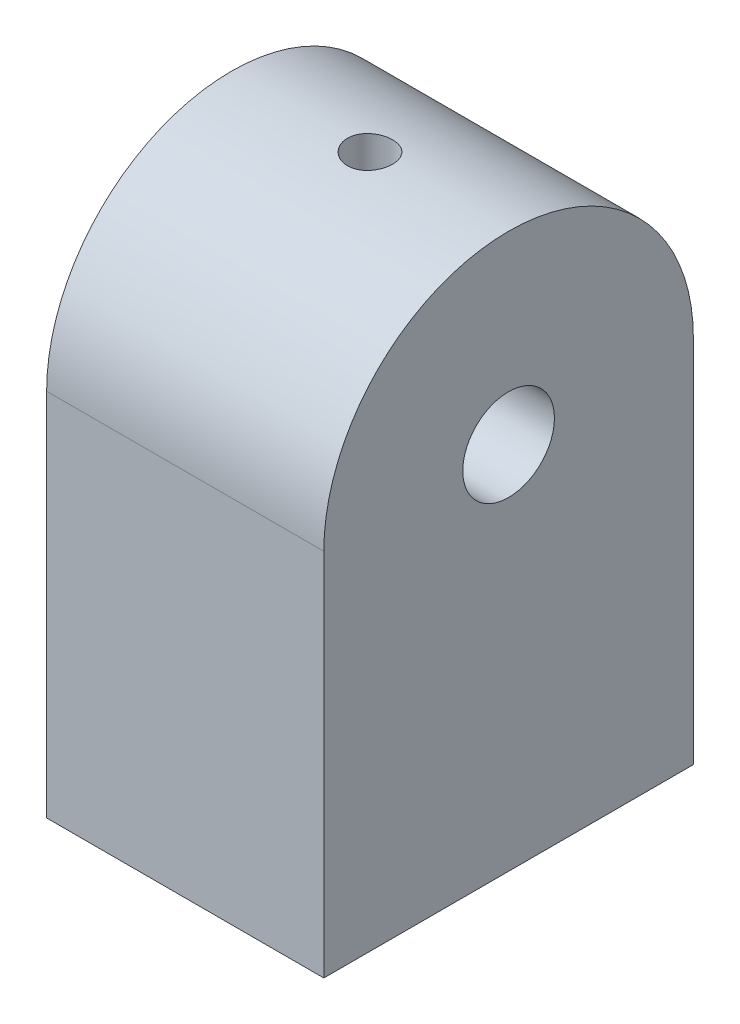
from build123d import *

# Parameters (mm, degrees)
SKETCH1_R               = 12.7
SKETCH1_R_2             = 3.15
BOSS_EXTRUDE1_DEPTH     = 19.05
BOSS_EXTRUDE2_START     = -19.05
BOSS_EXTRUDE2_DEPTH     = 19.05
CUT_EXTRUDE1_REACH      = 46.45
CUT_EXTRUDE1_END_RADIUS = 3.15
SKETCH3_R               = 1.55


with BuildPart() as part:
    # Sketch1 → Boss-Extrude1 (new body)
    with BuildSketch(Plane(origin=(0, 0, 0), x_dir=(0, 0, -1), z_dir=(1, 0, 0))):
        with Locations(Location((0, 0, 0), (0, 0, 180))):
            Circle(SKETCH1_R)
        with Locations(Location((0, 0, 0), (0, 0, 180))):
            Circle(SKETCH1_R_2, mode=Mode.SUBTRACT)
    extrude(amount=BOSS_EXTRUDE1_DEPTH)

    # Sketch2 → Boss-Extrude2 (add)
    with BuildSketch(Plane(origin=(19.05, 0, 0), x_dir=(0, 0, -1), z_dir=(1, 0, 0)).offset(BOSS_EXTRUDE2_START)):
        with BuildLine():
            Line((12.7, -25.4), (12.7, 0))
            ThreePointArc((12.7, 0), (0, -12.7), (-12.7, 0))
            Line((-12.7, 0), (-12.7, -25.4))
            Line((-12.7, -25.4), (12.7, -25.4))
        make_face()
    extrude(amount=BOSS_EXTRUDE2_DEPTH)

    # Cut-Extrude1: up to this cylinder (the profile starts outside it)
    cut_extrude1_end = Plane(origin=(9.525, 0, 0), z_dir=(-1, 0, 0)) * Cylinder(CUT_EXTRUDE1_END_RADIUS, 100.2, mode=Mode.PRIVATE)
    # Sketch3 → Cut-Extrude1 (cut, up to the surface)
    with BuildSketch(Plane(origin=(0, 12.7, 0), x_dir=(1, 0, 0), z_dir=(0, 1, 0)), mode=Mode.PRIVATE) as cut_extrude1_sk1:
        with Locations(Location((9.525, 0, 0), (0, 0, 270))):
            Circle(SKETCH3_R)
    cut_extrude1_tool1 = extrude(cut_extrude1_sk1.sketch, amount=-CUT_EXTRUDE1_REACH, mode=Mode.PRIVATE) - cut_extrude1_end
    add(cut_extrude1_tool1.solids().sort_by_distance((9.525, 12.7, 0))[0], mode=Mode.SUBTRACT)


solid = part.part
